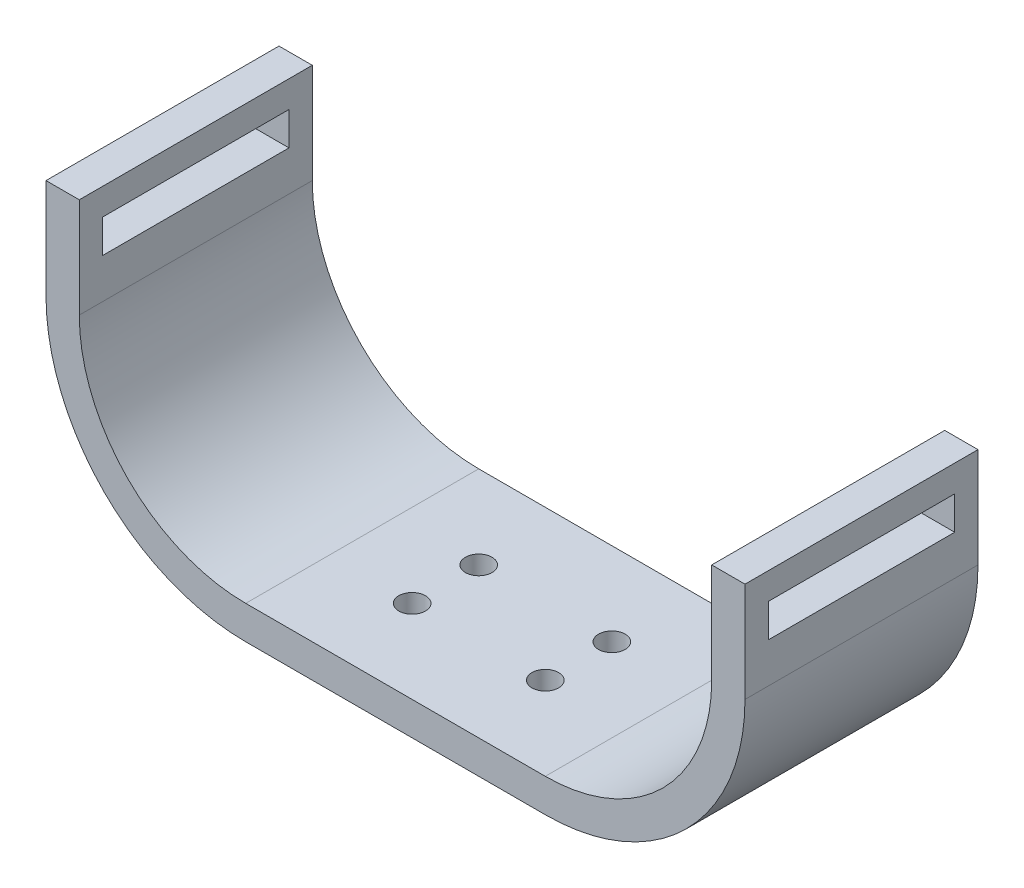
from build123d import *

# Parameters (mm, degrees)
EXTRUDE_1_DEPTH     = 35
SKETCH_3_W          = 28
SKETCH_3_H          = 5
CUT_EXTRUDE_1_DEPTH = 119.559064219
SKETCH_4_R          = 2
CUT_EXTRUDE_2_DEPTH = 75.707768298


with BuildPart() as part:
    # 草图1 → 凸台-拉伸1 (new body)
    with BuildSketch(Plane.XY):
        with BuildLine():
            Line((-52.500003752, 27.500001563), (-52.500003752, 42.500001563))
            Line((-52.500003752, 42.500001563), (-47.500003752, 42.500001563))
            Line((-47.500003752, 42.500001563), (-47.500003752, 27.500001563))
            ThreePointArc((-47.500003752, 27.500001563), (-40.17767174, 9.822329823), (-22.5, 2.499998437))
            Line((-22.5, 2.499998437), (22.5, 2.499998437))
            ThreePointArc((22.5, 2.499998437), (40.17767174, 9.822329823), (47.500003752, 27.500001563))
            Line((47.500003752, 27.500001563), (47.500003752, 42.500001563))
            Line((47.500003752, 42.500001563), (52.500003752, 42.500001563))
            Line((52.500003752, 42.500001563), (52.500003752, 27.500001563))
            ThreePointArc((52.500003752, 27.500001563), (43.713203436, 6.286798128), (22.5, -2.499998437))
            Line((22.5, -2.499998437), (-22.5, -2.499998437))
            ThreePointArc((-22.5, -2.499998437), (-43.713203436, 6.286798128), (-52.500003752, 27.500001563))
        make_face()
    extrude(amount=EXTRUDE_1_DEPTH)

    # 草图3 → 切除-拉伸1 (cut, through all)
    with BuildSketch(Plane(origin=(52.500003752, 0, 0), x_dir=(0, 0, -1), z_dir=(1, 0, 0))):
        with Locations((-17.5, 36.000001563)):
            Rectangle(SKETCH_3_W, SKETCH_3_H)
    extrude(amount=-CUT_EXTRUDE_1_DEPTH, mode=Mode.SUBTRACT)

    # 草图4 → 切除-拉伸2 (cut, through all)
    with BuildSketch(Plane(origin=(0, 2.499998437, 0), x_dir=(1, 0, 0), z_dir=(0, 1, 0))):
        with Locations(Location((-10, -12.5, 0), (0, 0, 180))):
            Circle(SKETCH_4_R)
        with Locations(Location((-10, -22.5, 0), (0, 0, 180))):
            Circle(SKETCH_4_R)
        with Locations((10, -22.5)):
            Circle(SKETCH_4_R)
        with Locations((10, -12.5)):
            Circle(SKETCH_4_R)
    extrude(amount=-CUT_EXTRUDE_2_DEPTH, mode=Mode.SUBTRACT)


solid = part.part
